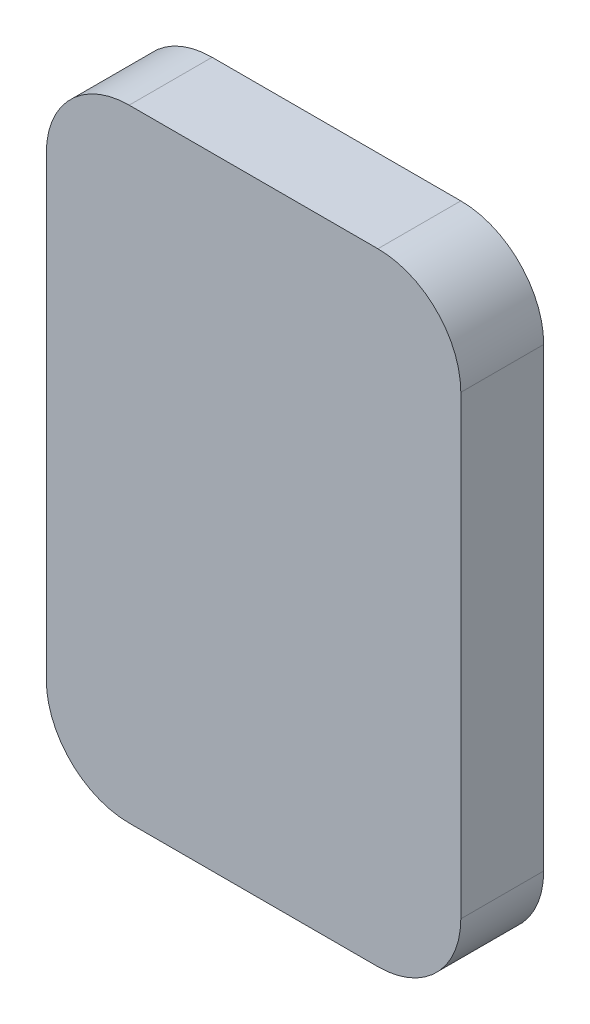
from build123d import *

# Parameters (mm, degrees)
SKETCH2_W           = 10
SKETCH2_H           = 2
BOSS_EXTRUDE1_DEPTH = 15
BOSS_EXTRUDE2_DEPTH = 4.9
FILLET1_R           = 2
FILLET2_R           = 1


with BuildPart() as part:
    # Sketch2 → Boss-Extrude1 (new body)
    with BuildSketch(Plane(origin=(0, 0, 0), x_dir=(1, 0, 0), z_dir=(0, 1, 0))):
        with Locations((-5.80018665, -2.25133902)):
            Rectangle(SKETCH2_W, SKETCH2_H)
    extrude(amount=BOSS_EXTRUDE1_DEPTH)

    # Sketch3 → Boss-Extrude2 (add)
    with BuildSketch(Plane(origin=(0, 7.5, 0), x_dir=(-1, 0, 0), z_dir=(0, -1, 0))):
        Polygon((4.80018665, -1.437939643), (4.80018665, -0.785111254), (4.40018665, 0.414888746), (4.40018665, 1.79866098), (7.20018665, 1.79866098), (7.20018665, 0.414888746), (6.80018665, -0.785111254), (6.80018665, -1.437939643), align=None)
    extrude(amount=BOSS_EXTRUDE2_DEPTH)

    # Fillet1
    fillet1_edges = [part.edges().sort_by_distance(p)[0] for p in [
        (-10.80018665, 15, 2.25133902),
        (-0.80018665, 15, 2.25133902),
        (-10.80018665, 0, 2.25133902),
        (-0.80018665, 0, 2.25133902),
    ]]
    fillet(fillet1_edges, radius=FILLET1_R)

    # Fillet2
    fillet2_edges = [part.edges().sort_by_distance(p)[0] for p in [
        (-5.80018665, 2.6, 1.25133902),
    ]]
    fillet(fillet2_edges, radius=FILLET2_R)


solid = part.part
